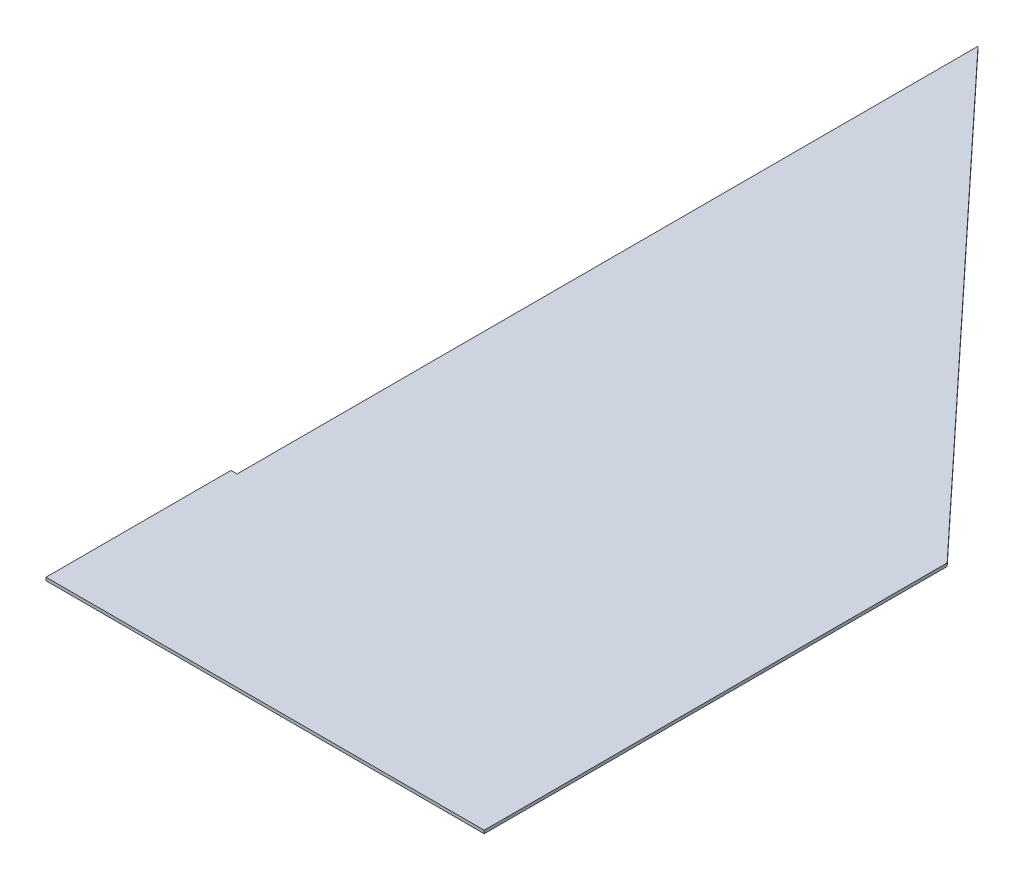
from build123d import *

# Parameters (mm, degrees)
ESTRUSIONE_ESTRUSIONE1_DEPTH = 1


with BuildPart() as part:
    # Forma aletta → Estrusione-Estrusione1 (new body)
    with BuildSketch(Plane(origin=(0, 0, 0), x_dir=(1, 0, 0), z_dir=(0, 1, 0))):
        Polygon((0, 300), (0, 59.93), (-2, 59.93), (-2, 0), (0, 0), (140, 0), (140, 150), align=None)
    extrude(amount=ESTRUSIONE_ESTRUSIONE1_DEPTH)


solid = part.part
